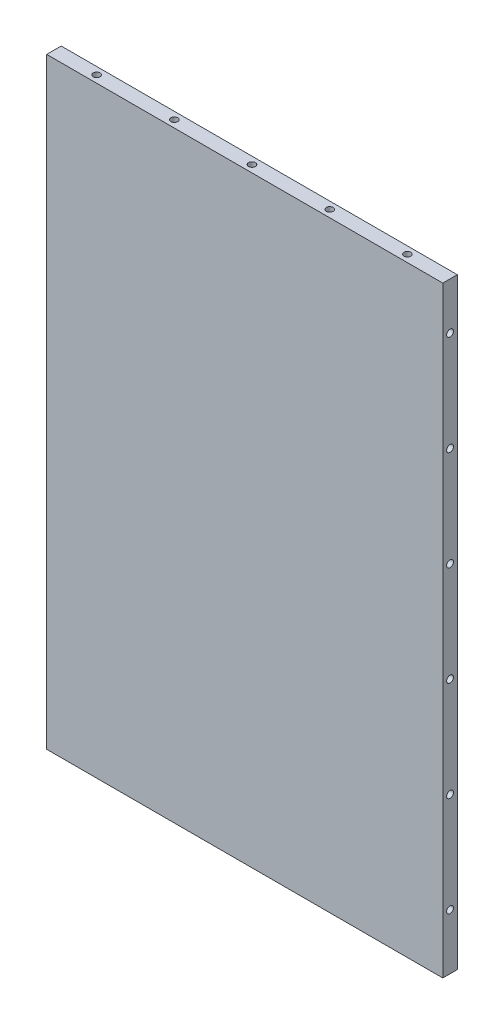
from build123d import *

# Parameters (mm, degrees)
SKETCH1_W                = 464
SKETCH1_H                = 705
BOSS_EXTRUDE1_DEPTH      = 17
CUT_EXTRUDE4_DEPTH       = 25
CUT_EXTRUDE4_DEPTH_BACK  = 13
SKETCH5_R                = 4
CUT_EXTRUDE12_START      = -13
SKETCH13_R               = 4
CUT_EXTRUDE12_DEPTH      = 38
CUT_EXTRUDE13_DEPTH      = 25
CUT_EXTRUDE13_DEPTH_BACK = 13
SKETCH14_R               = 4


with BuildPart() as part:
    # Sketch1 → Boss-Extrude1 (new body)
    with BuildSketch(Plane.XY):
        with Locations((0, -380.5)):
            Rectangle(SKETCH1_W, SKETCH1_H)
    extrude(amount=BOSS_EXTRUDE1_DEPTH)

    # Sketch5 → Cut-Extrude4 (cut, two sides: drawn at the far end of the back side and taken through both)
    with BuildSketch(Plane(origin=(0, -28, 254), x_dir=(1, 0, 0), z_dir=(0, -1, 0)).offset(-CUT_EXTRUDE4_DEPTH_BACK)):
        with Locations((182, -245.5)):
            Circle(SKETCH5_R)
        with Locations((-182, -245.5)):
            Circle(SKETCH5_R)
        with Locations((91, -245.5)):
            Circle(SKETCH5_R)
        with Locations((0, -245.5)):
            Circle(SKETCH5_R)
        with Locations((-91, -245.5)):
            Circle(SKETCH5_R)
    extrude(amount=CUT_EXTRUDE4_DEPTH + CUT_EXTRUDE4_DEPTH_BACK, mode=Mode.SUBTRACT)

    # Sketch13 → Cut-Extrude12 (cut)
    with BuildSketch(Plane(origin=(232, 0, 254), x_dir=(0, 0, 1), z_dir=(-1, 0, 0)).offset(CUT_EXTRUDE12_START)):
        with Locations(Location((-245.5, -83, 0), (0, 0, 270))):
            Circle(SKETCH13_R)
        with Locations(Location((-245.5, -200, 0), (0, 0, 270))):
            Circle(SKETCH13_R)
        with Locations(Location((-245.5, -317, 0), (0, 0, 270))):
            Circle(SKETCH13_R)
        with Locations(Location((-245.5, -434, 0), (0, 0, 270))):
            Circle(SKETCH13_R)
        with Locations(Location((-245.5, -551, 0), (0, 0, 270))):
            Circle(SKETCH13_R)
        with Locations(Location((-245.5, -668, 0), (0, 0, 270))):
            Circle(SKETCH13_R)
    cut_extrude12 = extrude(amount=CUT_EXTRUDE12_DEPTH, mode=Mode.SUBTRACT)

    # Mirror1: Cut-Extrude12 across plane
    add(cut_extrude12.mirror(Plane(origin=(0, 0, 0), x_dir=(0, 0, 1), z_dir=(1, 0, 0))), mode=Mode.SUBTRACT)

    # Sketch14 → Cut-Extrude13 (cut, two sides: drawn at the far end of the back side and taken through both)
    with BuildSketch(Plane(origin=(0, -733, 254), x_dir=(1, 0, 0), z_dir=(0, 1, 0)).offset(-CUT_EXTRUDE13_DEPTH_BACK)):
        with Locations((182, 245.5)):
            Circle(SKETCH14_R)
        with Locations((-182, 245.5)):
            Circle(SKETCH14_R)
        with Locations((91, 245.5)):
            Circle(SKETCH14_R)
        with Locations((0, 245.5)):
            Circle(SKETCH14_R)
        with Locations((-91, 245.5)):
            Circle(SKETCH14_R)
    extrude(amount=CUT_EXTRUDE13_DEPTH + CUT_EXTRUDE13_DEPTH_BACK, mode=Mode.SUBTRACT)


solid = part.part
